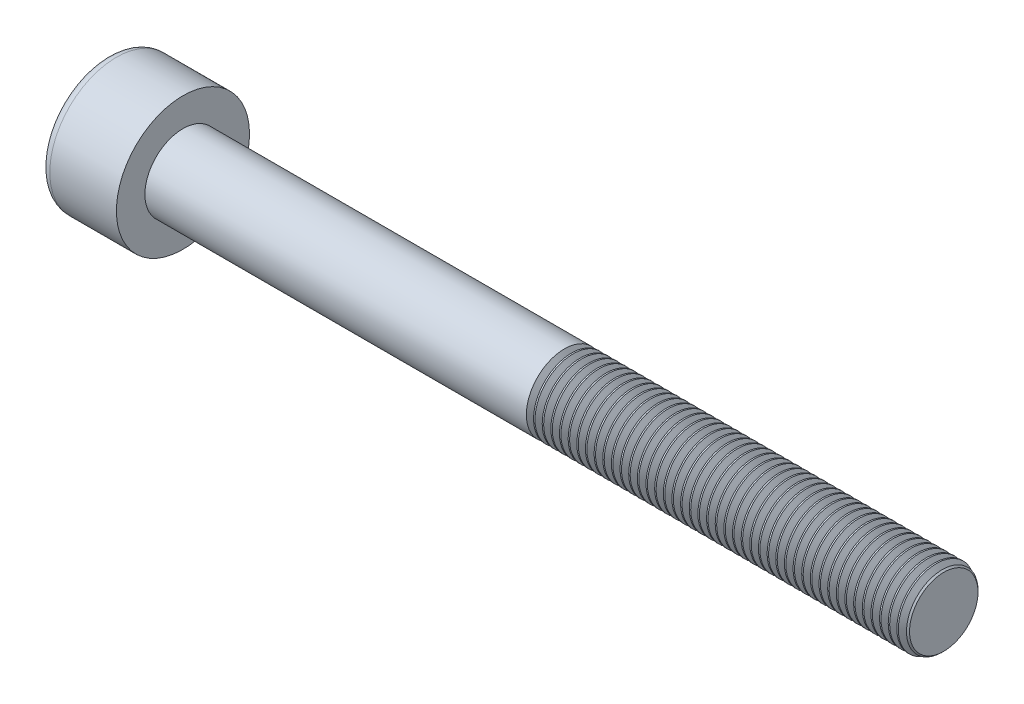
from build123d import *

# Parameters (mm, degrees)
SKETCH1_R           = 3.5
BASEHEAD_DEPTH      = 4
SKETCH2_R           = 2
BASEBODY_DEPTH      = 40
HEXAGONSOCKET_DEPTH = 2
TOPFILLET_R         = 0.5
CHAMFER1_SIZE       = 0.2
LPATTERN10_COUNT    = 44
LPATTERN10_PITCH    = 0.4548


with BuildPart() as part:
    # Sketch1 → BaseHead (new body)
    with BuildSketch(Plane(origin=(0, 0, 0), x_dir=(0, 0, -1), z_dir=(1, 0, 0))):
        Circle(SKETCH1_R)
    extrude(amount=BASEHEAD_DEPTH)

    # Sketch2 → BaseBody (add)
    with BuildSketch(Plane(origin=(4, 0, 0), x_dir=(0, 0, -1), z_dir=(1, 0, 0))):
        Circle(SKETCH2_R)
    extrude(amount=BASEBODY_DEPTH)

    # Sketch3 → HexagonSocket (cut)
    with BuildSketch(Plane(origin=(0, 0, 0), x_dir=(0, 0, -1), z_dir=(1, 0, 0))):
        Polygon((1.732050808, 0), (0.866025404, 1.5), (-0.866025404, 1.5), (-1.732050808, 0), (-0.866025404, -1.5), (0.866025404, -1.5), align=None)
    extrude(amount=HEXAGONSOCKET_DEPTH, mode=Mode.SUBTRACT)

    # Sketch4 → Cut-Revolve1 (revolve, cut)
    with BuildSketch(Plane(origin=(-4.19613823, 0.75, 0), x_dir=(-1, 0, 0), z_dir=(0, 0, 1)), mode=Mode.PRIVATE) as cut_revolve1_sk:
        Polygon((-6.19613823, 2.25), (-7.062163633, 0.75), (-6.19613823, 0.75), align=None)
    revolve(cut_revolve1_sk.sketch.rotate(Axis((0.838992387, 0, 0), (-1, 0, 0)), 90), axis=Axis((0.838992387, 0, 0), (-1, 0, 0)), mode=Mode.SUBTRACT)

    # TopFillet
    topfillet_edges = [part.edges().sort_by_distance(p)[0] for p in [
        (0, 0, 3.5),
    ]]
    fillet(topfillet_edges, radius=TOPFILLET_R)

    # Chamfer1
    chamfer1_edges = [part.edges().sort_by_distance(p)[0] for p in [
        (44, 0, 2),
    ]]
    chamfer(chamfer1_edges, length=CHAMFER1_SIZE)

    # Sketch5 → Cut-Revolve10 (revolve, cut)
    with BuildSketch(Plane.XY, mode=Mode.PRIVATE) as cut_revolve10_sk:
        Polygon((43.8, 1.671776372), (43.9895, 2), (43.9895, 2.379), (43.6105, 2.379), (43.6105, 2), align=None)
    cut_revolve10 = revolve(cut_revolve10_sk.sketch.rotate(Axis((0, 0, 0), (1, 0, 0)), 90), axis=Axis((0, 0, 0), (1, 0, 0)), mode=Mode.SUBTRACT)

    # LPattern10: Cut-Revolve10 ×44
    with Locations(*[(-i * LPATTERN10_PITCH, 0, 0) for i in range(1, LPATTERN10_COUNT)]):
        add(cut_revolve10, mode=Mode.SUBTRACT)


solid = part.part
